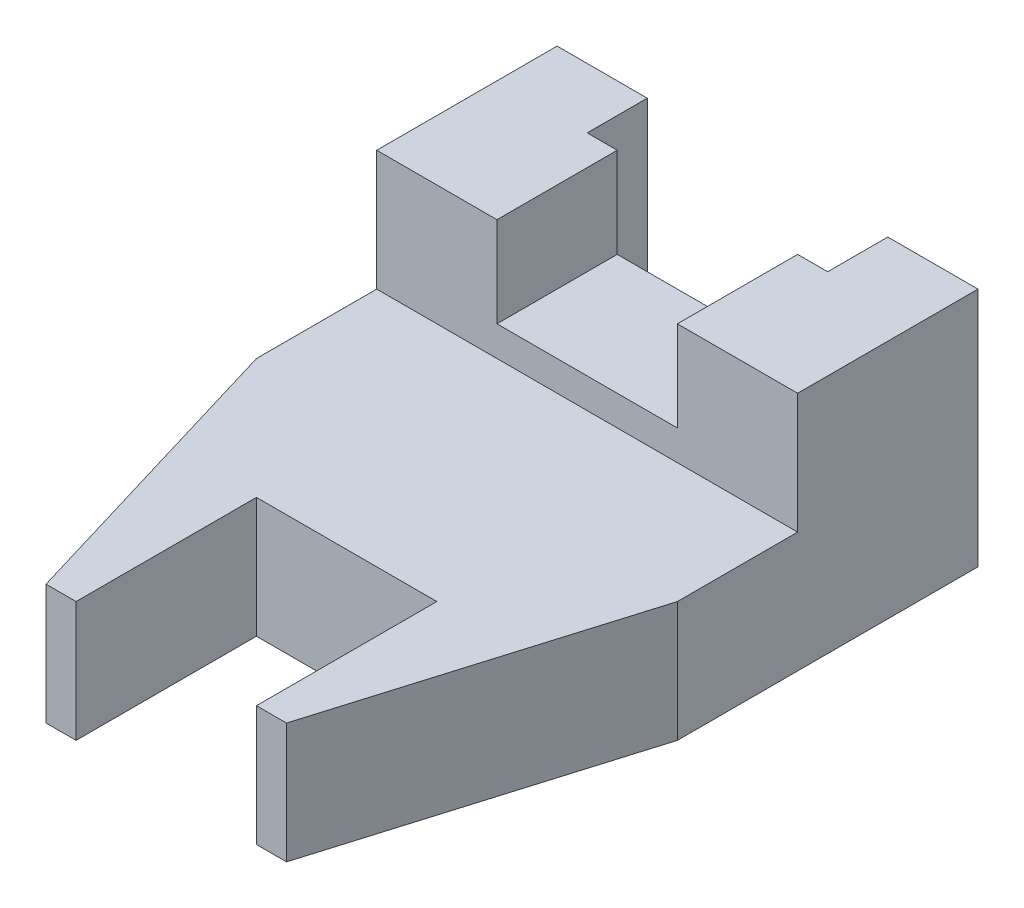
from build123d import *

# Parameters (mm, degrees)
BOSS_EXTRUDE1_DEPTH = 20
SKETCH2_W           = 70
SKETCH2_H           = 30
BOSS_EXTRUDE2_DEPTH = 20
CUT_EXTRUDE1_REACH  = 96.868
SKETCH3_W           = 40
SKETCH3_H           = 10
CUT_EXTRUDE2_REACH  = 108.771
SKETCH4_W           = 30
SKETCH4_H           = 15


with BuildPart() as part:
    # Sketch1 → Boss-Extrude1 (new body)
    with BuildSketch(Plane(origin=(0, 0, 0), x_dir=(1, 0, 0), z_dir=(0, 1, 0))):
        Polygon((0, 0), (0, 50), (70, 50), (70, 0), (55, -50), (50, -50), (50, -20), (20, -20), (20, -50), (15, -50), align=None)
    extrude(amount=BOSS_EXTRUDE1_DEPTH)

    # Sketch2 → Boss-Extrude2 (add)
    with BuildSketch(Plane(origin=(0, 20, 0), x_dir=(1, 0, 0), z_dir=(0, 1, 0))):
        with Locations((35, 35)):
            Rectangle(SKETCH2_W, SKETCH2_H)
    extrude(amount=BOSS_EXTRUDE2_DEPTH)

    # Sketch3 → Cut-Extrude1 (cut, up to next)
    with BuildSketch(Plane(origin=(0, 40, 0), x_dir=(1, 0, 0), z_dir=(0, 1, 0)), mode=Mode.PRIVATE) as cut_extrude1_sk1:
        with Locations((35, 45)):
            Rectangle(SKETCH3_W, SKETCH3_H)
    cut_extrude1_tool1 = extrude(cut_extrude1_sk1.sketch, amount=-CUT_EXTRUDE1_REACH, mode=Mode.PRIVATE) & part.part
    add(cut_extrude1_tool1.solids().sort_by_distance((35, 40, -45))[0], mode=Mode.SUBTRACT)

    # Sketch4 → Cut-Extrude2 (cut, up to next)
    with BuildSketch(Plane.XY.offset(-20), mode=Mode.PRIVATE) as cut_extrude2_sk1:
        with Locations((35, 32.5)):
            Rectangle(SKETCH4_W, SKETCH4_H)
    cut_extrude2_tool1 = extrude(cut_extrude2_sk1.sketch, amount=-CUT_EXTRUDE2_REACH, mode=Mode.PRIVATE) & part.part
    add(cut_extrude2_tool1.solids().sort_by_distance((35, 32.5, -20))[0], mode=Mode.SUBTRACT)


solid = part.part
